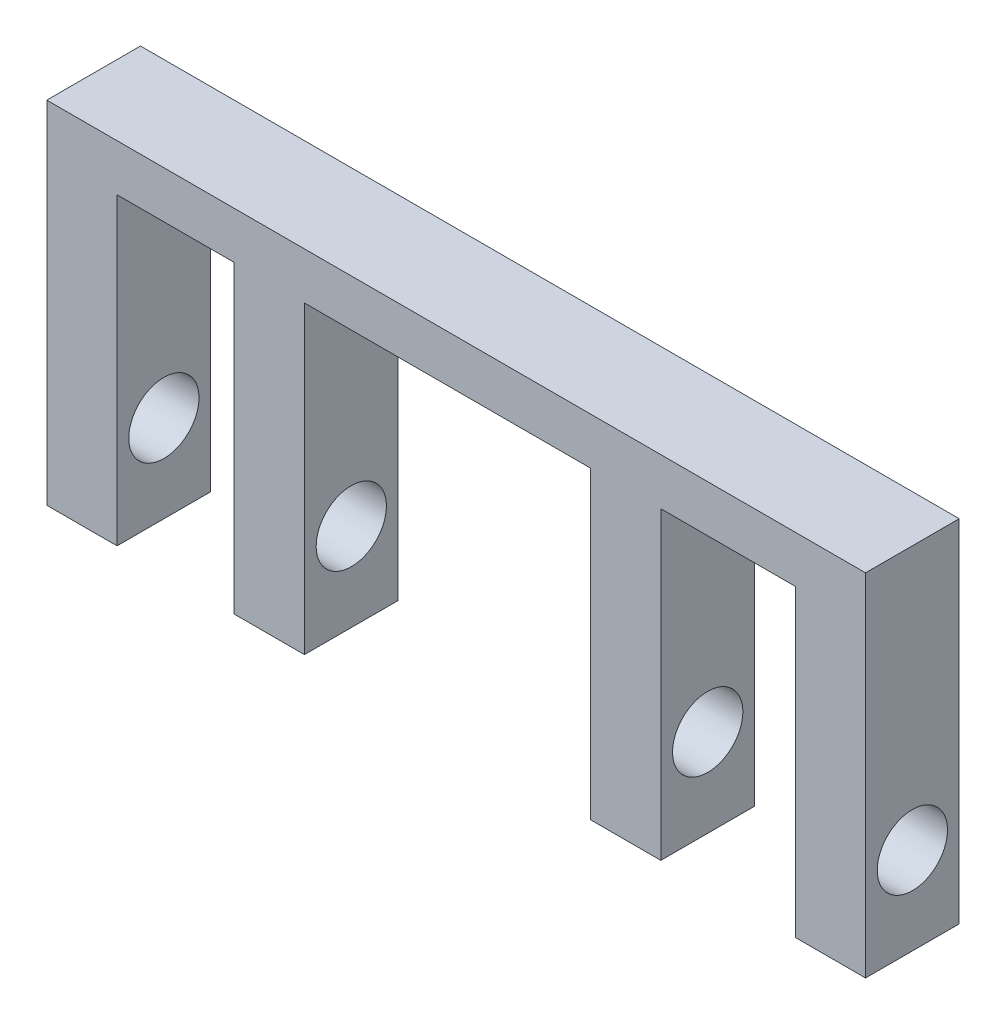
from build123d import *

# Parameters (mm, degrees)
BOSS_EXTRUDE1_DEPTH = 40
SKETCH2_W           = 30
SKETCH2_H           = 40
BOSS_EXTRUDE2_DEPTH = 130
CUT_EXTRUDE1_DEPTH  = 410


with BuildPart() as part:
    # Sketch1 → Boss-Extrude1 (new body)
    with BuildSketch(Plane.XY):
        Polygon((0, 149.79), (0, 0), (30, 0), (30, 129.79), (319.51, 129.79), (319.51, 0), (349.51, 0), (349.51, 149.79), align=None)
    extrude(amount=BOSS_EXTRUDE1_DEPTH)

    # Sketch2 → Boss-Extrude2 (add)
    with BuildSketch(Plane.XZ.offset(-129.79)):
        with Locations((95, 20)):
            Rectangle(SKETCH2_W, SKETCH2_H)
        with Locations((247.128263463, 20)):
            Rectangle(SKETCH2_W, SKETCH2_H)
    extrude(amount=BOSS_EXTRUDE2_DEPTH)

    # Sketch4 → Cut-Extrude1 (cut)
    with BuildSketch(Plane.ZY):
        with BuildLine():
            ThreePointArc((20, 52.29), (5, 37.29), (20, 22.29))
            Line((20, 22.29), (20, 52.29))
        make_face()
        with BuildLine():
            Line((20, 52.29), (20, 22.29))
            ThreePointArc((20, 22.29), (30.606601718, 26.683398282), (35, 37.29))
            ThreePointArc((35, 37.29), (30.606601718, 47.896601718), (20, 52.29))
        make_face()
    extrude(amount=-CUT_EXTRUDE1_DEPTH, mode=Mode.SUBTRACT)


solid = part.part
